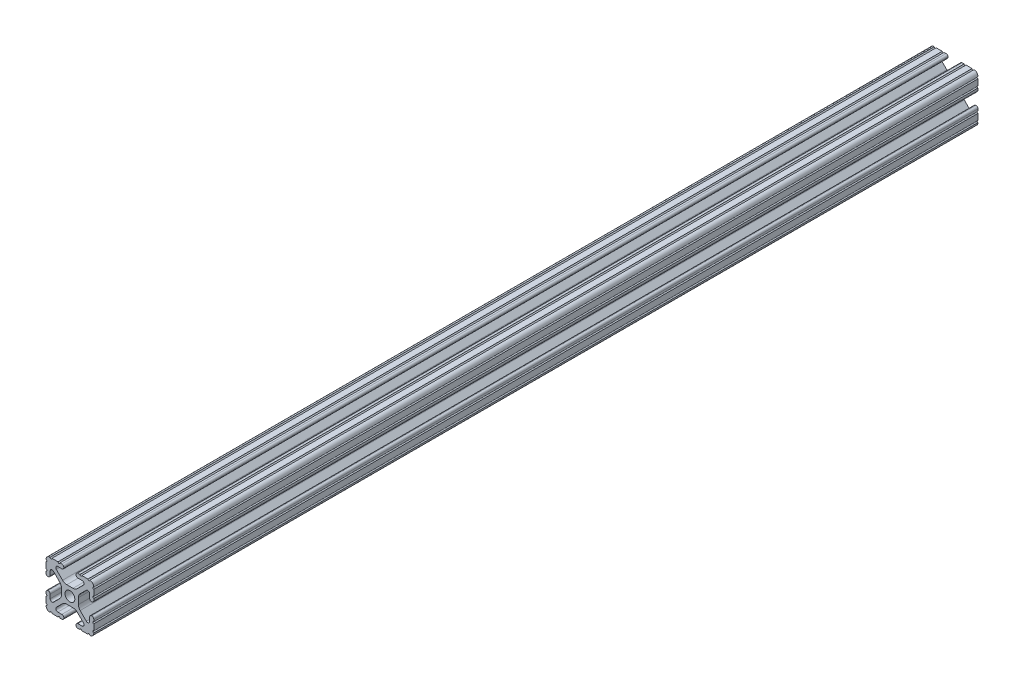
from build123d import *

# Parameters (mm, degrees)
SKETCH1_R           = 2.6035
BOSS_EXTRUDE1_DEPTH = 234.95


with BuildPart() as part:
    # Sketch1 → Boss-Extrude1 (new, symmetric)
    with BuildSketch(Plane.XY):
        with BuildLine():
            Line((-7.179650497, -8.645192506), (-3.952270251, -5.423690499))
            ThreePointArc((-3.952270251, -5.423690499), (-2.922936451, -4.736929036), (-1.709253557, -4.4958))
            Line((-1.709253557, -4.4958), (1.709253557, -4.4958))
            ThreePointArc((1.709253557, -4.4958), (2.922936451, -4.736929036), (3.952270251, -5.423690499))
            Line((3.952270251, -5.423690499), (7.179650497, -8.645192506))
            ThreePointArc((7.179650497, -8.645192506), (7.41473083, -9.822813117), (6.416408329, -10.4902))
            Line((6.416408329, -10.4902), (4.287512407, -10.4902))
            ThreePointArc((4.287512407, -10.4902), (3.54574862, -10.79744862), (3.2385, -11.539212407))
            Line((3.2385, -11.539212407), (3.2385, -11.650987593))
            ThreePointArc((3.2385, -11.650987593), (3.54574862, -12.39275138), (4.287512407, -12.7))
            Line((4.287512407, -12.7), (5.317126718, -12.7))
            ThreePointArc((5.317126718, -12.7), (5.825126718, -12.192), (6.333126718, -12.7))
            Line((6.333126718, -12.7), (9.550443118, -12.7))
            ThreePointArc((9.550443118, -12.7), (10.058366869, -12.192000006), (10.566443095, -12.699847501))
            ThreePointArc((10.566443095, -12.699847501), (12.082537762, -12.08250727), (12.699846982, -10.566399977))
            ThreePointArc((12.699846982, -10.566399977), (12.192000006, -10.058323491), (12.7, -9.5504))
            Line((12.7, -9.5504), (12.7, -6.3330836))
            ThreePointArc((12.7, -6.3330836), (12.192, -5.8250836), (12.7, -5.3170836))
            Line((12.7, -5.3170836), (12.7, -4.287469289))
            ThreePointArc((12.7, -4.287469289), (12.39275138, -3.545705502), (11.650987593, -3.238456882))
            Line((11.650987593, -3.238456882), (11.539212407, -3.238456882))
            ThreePointArc((11.539212407, -3.238456882), (10.79744862, -3.545705502), (10.4902, -4.287469289))
            Line((10.4902, -4.287469289), (10.4902, -6.402089023))
            ThreePointArc((10.4902, -6.402089023), (9.856505071, -7.351067942), (8.737131347, -7.129408934))
            Line((8.737131347, -7.129408934), (5.441005833, -3.840816462))
            ThreePointArc((5.441005833, -3.840816462), (4.750877967, -2.809883091), (4.5085, -1.593185507))
            Line((4.5085, -1.593185507), (4.5085, 1.593185507))
            ThreePointArc((4.5085, 1.593185507), (4.750877967, 2.809883091), (5.441005833, 3.840816462))
            Line((5.441005833, 3.840816462), (8.737131347, 7.129408934))
            ThreePointArc((8.737131347, 7.129408934), (9.856505071, 7.351067942), (10.4902, 6.402089023))
            Line((10.4902, 6.402089023), (10.4902, 4.287469289))
            ThreePointArc((10.4902, 4.287469289), (10.79744862, 3.545705502), (11.539212407, 3.238456882))
            Line((11.539212407, 3.238456882), (11.650987593, 3.238456882))
            ThreePointArc((11.650987593, 3.238456882), (12.39275138, 3.545705502), (12.7, 4.287469289))
            Line((12.7, 4.287469289), (12.7, 5.3170836))
            ThreePointArc((12.7, 5.3170836), (12.192, 5.8250836), (12.7, 6.3330836))
            Line((12.7, 6.3330836), (12.7, 9.5504))
            ThreePointArc((12.7, 9.5504), (12.192000006, 10.058323491), (12.699846982, 10.566399977))
            ThreePointArc((12.699846982, 10.566399977), (12.082537762, 12.08250727), (10.566443095, 12.699847501))
            ThreePointArc((10.566443095, 12.699847501), (10.058366869, 12.192000006), (9.550443118, 12.7))
            Line((9.550443118, 12.7), (6.333126718, 12.7))
            ThreePointArc((6.333126718, 12.7), (5.825126718, 12.192), (5.317126718, 12.7))
            Line((5.317126718, 12.7), (4.287512407, 12.7))
            ThreePointArc((4.287512407, 12.7), (3.54574862, 12.39275138), (3.2385, 11.650987593))
            Line((3.2385, 11.650987593), (3.2385, 11.539212407))
            ThreePointArc((3.2385, 11.539212407), (3.54574862, 10.79744862), (4.287512407, 10.4902))
            Line((4.287512407, 10.4902), (6.476788598, 10.4902))
            ThreePointArc((6.476788598, 10.4902), (7.432222385, 9.85140422), (7.207036008, 8.724370562))
            Line((7.207036008, 8.724370562), (3.898272566, 5.423169045))
            ThreePointArc((3.898272566, 5.423169045), (2.869120213, 4.736787962), (1.655778399, 4.4958))
            Line((1.655778399, 4.4958), (-1.655778399, 4.4958))
            ThreePointArc((-1.655778399, 4.4958), (-2.869120213, 4.736787962), (-3.898272566, 5.423169045))
            Line((-3.898272566, 5.423169045), (-7.207036008, 8.724370562))
            ThreePointArc((-7.207036008, 8.724370562), (-7.432222385, 9.85140422), (-6.476788598, 10.4902))
            Line((-6.476788598, 10.4902), (-4.287512407, 10.4902))
            ThreePointArc((-4.287512407, 10.4902), (-3.54574862, 10.79744862), (-3.2385, 11.539212407))
            Line((-3.2385, 11.539212407), (-3.2385, 11.650987593))
            ThreePointArc((-3.2385, 11.650987593), (-3.54574862, 12.39275138), (-4.287512407, 12.7))
            Line((-4.287512407, 12.7), (-5.317126718, 12.7))
            ThreePointArc((-5.317126718, 12.7), (-5.825126718, 12.192), (-6.333126718, 12.7))
            Line((-6.333126718, 12.7), (-9.550443118, 12.7))
            ThreePointArc((-9.550443118, 12.7), (-10.058366869, 12.192000006), (-10.566443095, 12.699847501))
            ThreePointArc((-10.566443095, 12.699847501), (-12.082537762, 12.08250727), (-12.699846982, 10.566399977))
            ThreePointArc((-12.699846982, 10.566399977), (-12.192000006, 10.058323491), (-12.7, 9.5504))
            Line((-12.7, 9.5504), (-12.7, 6.3330836))
            ThreePointArc((-12.7, 6.3330836), (-12.192, 5.8250836), (-12.7, 5.3170836))
            Line((-12.7, 5.3170836), (-12.7, 4.287469289))
            ThreePointArc((-12.7, 4.287469289), (-12.39275138, 3.545705502), (-11.650987593, 3.238456882))
            Line((-11.650987593, 3.238456882), (-11.539212407, 3.238456882))
            ThreePointArc((-11.539212407, 3.238456882), (-10.79744862, 3.545705502), (-10.4902, 4.287469289))
            Line((-10.4902, 4.287469289), (-10.4902, 6.402089023))
            ThreePointArc((-10.4902, 6.402089023), (-9.856505071, 7.351067942), (-8.737131347, 7.129408934))
            Line((-8.737131347, 7.129408934), (-5.441005833, 3.840816462))
            ThreePointArc((-5.441005833, 3.840816462), (-4.750877967, 2.809883091), (-4.5085, 1.593185507))
            Line((-4.5085, 1.593185507), (-4.5085, -1.593185507))
            ThreePointArc((-4.5085, -1.593185507), (-4.750877967, -2.809883091), (-5.441005833, -3.840816462))
            Line((-5.441005833, -3.840816462), (-8.737131347, -7.129408934))
            ThreePointArc((-8.737131347, -7.129408934), (-9.856505071, -7.351067942), (-10.4902, -6.402089023))
            Line((-10.4902, -6.402089023), (-10.4902, -4.287469289))
            ThreePointArc((-10.4902, -4.287469289), (-10.79744862, -3.545705502), (-11.539212407, -3.238456882))
            Line((-11.539212407, -3.238456882), (-11.650987593, -3.238456882))
            ThreePointArc((-11.650987593, -3.238456882), (-12.39275138, -3.545705502), (-12.7, -4.287469289))
            Line((-12.7, -4.287469289), (-12.7, -5.3170836))
            ThreePointArc((-12.7, -5.3170836), (-12.192, -5.8250836), (-12.7, -6.3330836))
            Line((-12.7, -6.3330836), (-12.7, -9.5504))
            ThreePointArc((-12.7, -9.5504), (-12.192000006, -10.058323491), (-12.699846982, -10.566399977))
            ThreePointArc((-12.699846982, -10.566399977), (-12.082537762, -12.08250727), (-10.566443095, -12.699847501))
            ThreePointArc((-10.566443095, -12.699847501), (-10.058366869, -12.192000006), (-9.550443118, -12.7))
            Line((-9.550443118, -12.7), (-6.333126718, -12.7))
            ThreePointArc((-6.333126718, -12.7), (-5.825126718, -12.192), (-5.317126718, -12.7))
            Line((-5.317126718, -12.7), (-4.287512407, -12.7))
            ThreePointArc((-4.287512407, -12.7), (-3.54574862, -12.39275138), (-3.2385, -11.650987593))
            Line((-3.2385, -11.650987593), (-3.2385, -11.539212407))
            ThreePointArc((-3.2385, -11.539212407), (-3.54574862, -10.79744862), (-4.287512407, -10.4902))
            Line((-4.287512407, -10.4902), (-6.416408329, -10.4902))
            ThreePointArc((-6.416408329, -10.4902), (-7.41473083, -9.822813117), (-7.179650497, -8.645192506))
        make_face()
        Circle(SKETCH1_R, mode=Mode.SUBTRACT)
    extrude(amount=BOSS_EXTRUDE1_DEPTH, both=True)


solid = part.part
